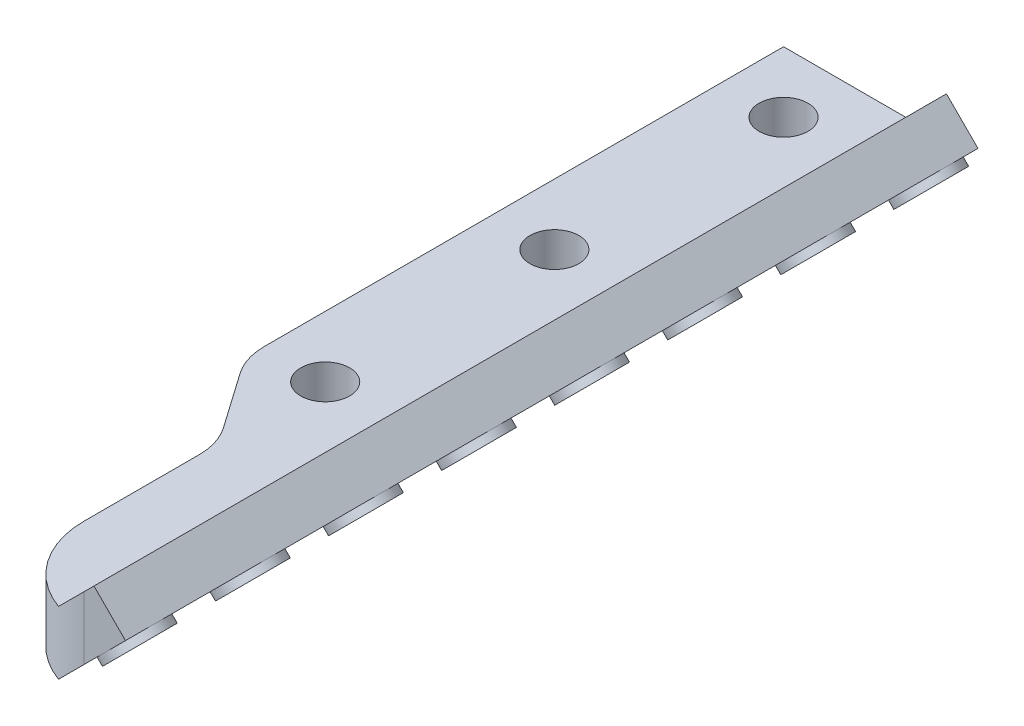
from build123d import *

# Parameters (mm, degrees)
EXTRUDE_1_DEPTH        = 63.5
SKETCH_2_R             = 2
EXTRUDE_4_DEPTH        = 0.5
PATTERN_LINEAR_2_COUNT = 9
PATTERN_LINEAR_2_PITCH = 7.4
SKETCH_4_R             = 1.6
CUT_EXTRUDE_1_DEPTH    = 10.5
PATTERN_LINEAR_3_COUNT = 3
PATTERN_LINEAR_3_PITCH = 15
CUT_EXTRUDE_2_DEPTH    = 20
FILLET_1_R             = 6
FILLET_2_R             = 4


with BuildPart() as part:
    # 草图1 → 凸台-拉伸1 (new body)
    with BuildSketch(Plane.XY):
        Polygon((12.374107166, 7.245427509), (12.727660556, 7.5989809), (10.663320728, 9.663320728), (8, 7), (0, 7), (0, 2.871320344), (8, 2.871320344), (10.252786822, 5.124107166), align=None)
    extrude(amount=EXTRUDE_1_DEPTH)

    # 草图2 → 凸台-拉伸4 (add)
    with BuildSketch(Plane(origin=(2.564339828, -2.564339828, 0), x_dir=(0, 0, -1), z_dir=(0.7071067811865562, -0.7071067811865389, 0))):
        with Locations(Location((-2, 12.373106012, 0), (0, 0, 90))):
            Circle(SKETCH_2_R)
    extrude_4 = extrude(amount=EXTRUDE_4_DEPTH)

    # 阵列(线性)2: 凸台-拉伸4 ×9
    with Locations(*[(0, 0, i * PATTERN_LINEAR_2_PITCH) for i in range(1, PATTERN_LINEAR_2_COUNT)]):
        add(extrude_4)

    # 草图4 → 切除-拉伸1 (cut)
    with BuildSketch(Plane(origin=(0, 7, 0), x_dir=(1, 0, 0), z_dir=(0, 1, 0))):
        with Locations(Location((4, -4, 0), (0, 0, 180))):
            Circle(SKETCH_4_R)
    cut_extrude_1 = extrude(amount=-CUT_EXTRUDE_1_DEPTH, mode=Mode.SUBTRACT)

    # 阵列(线性)3: 切除-拉伸1 ×3
    with Locations(*[(0, 0, i * PATTERN_LINEAR_3_PITCH) for i in range(1, PATTERN_LINEAR_3_COUNT)]):
        add(cut_extrude_1, mode=Mode.SUBTRACT)

    # 草图5 → 切除-拉伸2 (cut, symmetric)
    with BuildSketch(Plane(origin=(0, 7, 0), x_dir=(1, 0, 0), z_dir=(0, 1, 0))):
        with BuildLine():
            Line((4, -40.973787182), (0.723391823, -36.294305745))
            ThreePointArc((0.723391823, -36.294305745), (0.185132197, -35.202823198), (0, -34))
            Line((0, -34), (-5.450044849, -34))
            Line((-5.450044849, -34), (-5.450044849, -68.07872052))
            Line((-5.450044849, -68.07872052), (16.294093075, -68.07872052))
            Line((16.294093075, -68.07872052), (16.294093075, -55.8))
            Line((16.294093075, -55.8), (4, -55.8))
            Line((4, -55.8), (4, -40.973787182))
        make_face()
    extrude(amount=CUT_EXTRUDE_2_DEPTH, both=True, mode=Mode.SUBTRACT)

    # 圆角1
    fillet_1_edges = [part.edges().sort_by_distance(p)[0] for p in [
        (4, 4.935660172, 55.8),
    ]]
    fillet(fillet_1_edges, radius=FILLET_1_R)

    # 圆角2
    fillet_2_edges = [part.edges().sort_by_distance(p)[0] for p in [
        (4, 4.935660172, 40.973787182),
    ]]
    fillet(fillet_2_edges, radius=FILLET_2_R)


solid = part.part
